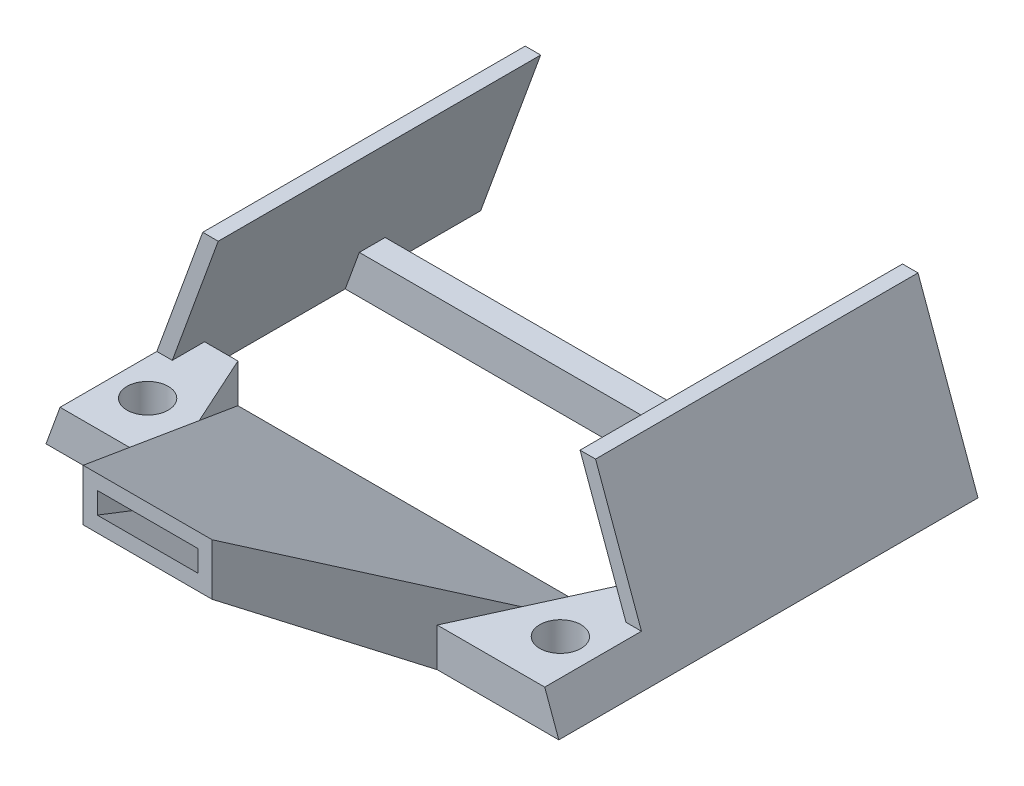
from build123d import *

# Parameters (mm, degrees)
EXTRUDE_3_DEPTH     = 15
CUT_EXTRUDE_1_DEPTH = 30
SHELL_3_T           = -1
EXTRUDE_4_DEPTH     = 12.5
EXTRUDE_4_2_DEPTH   = 12.5
SKETCH_6_R          = 1.6
SKETCH_6_W          = 40
SKETCH_6_H          = 2
EXTRUDE_5_DEPTH     = 3
CUT_EXTRUDE_2_DEPTH = 61


with BuildPart() as part:
    # 草圖2 → 填料-伸長3 (new, symmetric)
    with BuildSketch(Plane(origin=(0, 0, 0), x_dir=(0, 0, -1), z_dir=(1, 0, 0))):
        Polygon((-20, 0), (-10, 0), (-32, 12), (-32, 8), align=None)
    extrude(amount=EXTRUDE_3_DEPTH, both=True)

    # 草圖3 → 除料-伸長1 (cut)
    with BuildSketch(Plane(origin=(0, 0, 0), x_dir=(1, 0, 0), z_dir=(0, 1, 0))):
        Polygon((-15, -10), (-15, -32), (-5, -32), align=None)
        Polygon((5, -32), (15, -10), (15, -32), align=None)
    extrude(amount=CUT_EXTRUDE_1_DEPTH, mode=Mode.SUBTRACT)

    # 薄殼3
    shell_3_openings = [part.faces().sort_by_distance(p)[0] for p in [
        (0, 10, 32),
        (0, 0, 14.702380952),
    ]]
    offset(amount=SHELL_3_T, openings=shell_3_openings, kind=Kind.INTERSECTION)



with BuildPart() as body_2:
    # 草圖5 → 填料-伸長4 (new, symmetric)
    with BuildSketch(Plane.XY):
        Polygon((-19.878151447, 0), (-15.226425738, 12.780511349), (-14.026425738, 12.780511349), (-18.678151447, 0), align=None)
    extrude(amount=EXTRUDE_4_DEPTH, both=True)


with BuildPart() as body_3:
    # 草圖5 → Extrude 4 2 (new, symmetric)
    with BuildSketch(Plane.XY):
        Polygon((18.678151447, 0), (19.878151447, 0), (15.226425738, 12.780511349), (14.026425738, 12.780511349), align=None)
    extrude(amount=EXTRUDE_4_2_DEPTH, both=True)


with BuildPart() as part_1:
    add(part.part)

    add(body_2.part)  # 填料-伸長5 merges body 2

    add(body_3.part)  # 填料-伸長5 merges body 3
    # 草圖6 → 填料-伸長5 (add)
    # profile 1 of 3: a face of its own
    with BuildSketch(Plane(origin=(0, 0, 0), x_dir=(1, 0, 0), z_dir=(0, 1, 0))):
        Polygon((-20, -10), (-15, -10), (-10.454545455, -20), (-20, -20), align=None)
        with Locations(Location((-16, -16, 0), (0, 0, 270))):
            Circle(SKETCH_6_R, mode=Mode.SUBTRACT)
    # profile 2 of 3: a face of its own
    with BuildSketch(Plane(origin=(0, 0, 0), x_dir=(1, 0, 0), z_dir=(0, 1, 0))):
        Polygon((20, -20), (20, -10), (15, -10), (10.454545455, -20), align=None)
        with Locations(Location((16, -16, 0), (0, 0, 90))):
            Circle(SKETCH_6_R, mode=Mode.SUBTRACT)
    # profile 3 of 3: a face of its own
    with BuildSketch(Plane(origin=(0, 0, 0), x_dir=(1, 0, 0), z_dir=(0, 1, 0))):
        with Locations((0, 3)):
            Rectangle(SKETCH_6_W, SKETCH_6_H)
    extrude(amount=EXTRUDE_5_DEPTH)

    # 草圖7 → 除料-伸長2 (cut)
    with BuildSketch(Plane(origin=(0, 0, -12.5), x_dir=(-1, 0, 0), z_dir=(0, 0, -1))):
        Polygon((-20, 3), (-18.786240745, 3), (-19.878151447, 0), (-20, 0), align=None)
        Polygon((20, 0), (20, 3), (18.786240745, 3), (19.878151447, 0), align=None)
    extrude(amount=-CUT_EXTRUDE_2_DEPTH, mode=Mode.SUBTRACT)


solid = part_1.part
